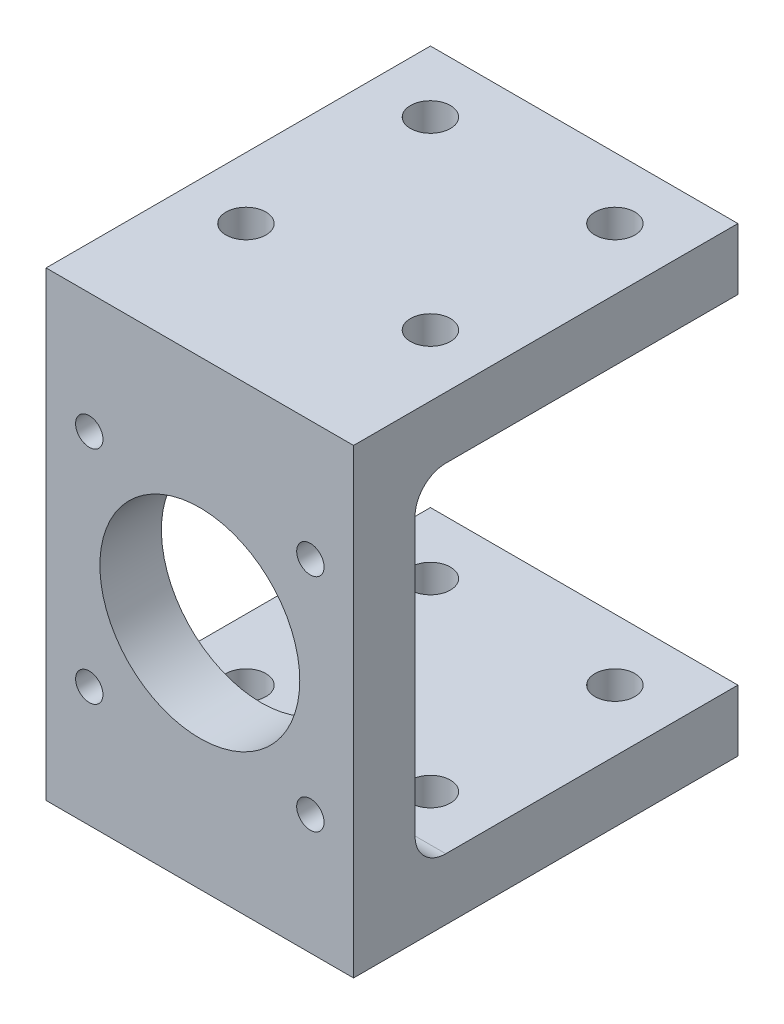
from build123d import *

# Parameters (mm, degrees)
SKETCH1_W                                    = 25.4
SKETCH1_H                                    = 38.1
SKETCH1_R                                    = 8.255
SKETCH1_R_2                                  = 1.1303
BOSS_EXTRUDE_WITH_4_40_TAP_DRILL_HOLES_DEPTH = 15.875
CUT_EXTRUDE1_REACH                           = 37.498
SKETCH3_W                                    = 26.67
SKETCH3_H                                    = 27.94
FILLET1_R                                    = 2.54
SKETCH5_R                                    = 1.65
CLEARANCE_HOLES_FOR_M3_SCREW_DEPTH           = 44.184668865


with BuildPart() as part:
    # Sketch1 → Boss-Extrude with 4-40 Tap Drill Holes (new, symmetric)
    with BuildSketch(Plane.XY):
        Rectangle(SKETCH1_W, SKETCH1_H)
        Circle(SKETCH1_R, mode=Mode.SUBTRACT)
        with Locations((-9.1313, 9.1313)):
            Circle(SKETCH1_R_2, mode=Mode.SUBTRACT)
        with Locations((9.1313, 9.1313)):
            Circle(SKETCH1_R_2, mode=Mode.SUBTRACT)
        with Locations((-9.1313, -9.1313)):
            Circle(SKETCH1_R_2, mode=Mode.SUBTRACT)
        with Locations((9.1313, -9.1313)):
            Circle(SKETCH1_R_2, mode=Mode.SUBTRACT)
    extrude(amount=BOSS_EXTRUDE_WITH_4_40_TAP_DRILL_HOLES_DEPTH, both=True)

    # Sketch3 → Cut-Extrude1 (cut, up to next)
    with BuildSketch(Plane(origin=(12.7, 0, 0), x_dir=(0, 0, -1), z_dir=(1, 0, 0)), mode=Mode.PRIVATE) as cut_extrude1_sk1:
        with Locations((2.54, 0)):
            Rectangle(SKETCH3_W, SKETCH3_H)
    cut_extrude1_tool1 = extrude(cut_extrude1_sk1.sketch, amount=-CUT_EXTRUDE1_REACH, mode=Mode.PRIVATE) & part.part
    add(cut_extrude1_tool1.solids().sort_by_distance((12.7, 0, -2.54))[0], mode=Mode.SUBTRACT)

    # Fillet1
    fillet1_edges = [part.edges().sort_by_distance(p)[0] for p in [
        (0, -13.97, 10.795),
        (0, 13.97, 10.795),
    ]]
    fillet(fillet1_edges, radius=FILLET1_R)

    # Sketch5 → Clearance Holes for M3 Screw (cut, through all)
    with BuildSketch(Plane(origin=(0, 19.05, 0), x_dir=(1, 0, 0), z_dir=(0, 1, 0))):
        with Locations(Location((-7.62, 10.795, 0), (0, 0, 270))):
            Circle(SKETCH5_R)
        with Locations(Location((-7.62, -4.445, 0), (0, 0, 270))):
            Circle(SKETCH5_R)
        with Locations(Location((7.62, -4.445, 0), (0, 0, 270))):
            Circle(SKETCH5_R)
        with Locations(Location((7.62, 10.795, 0), (0, 0, 270))):
            Circle(SKETCH5_R)
    extrude(amount=-CLEARANCE_HOLES_FOR_M3_SCREW_DEPTH, mode=Mode.SUBTRACT)


solid = part.part
